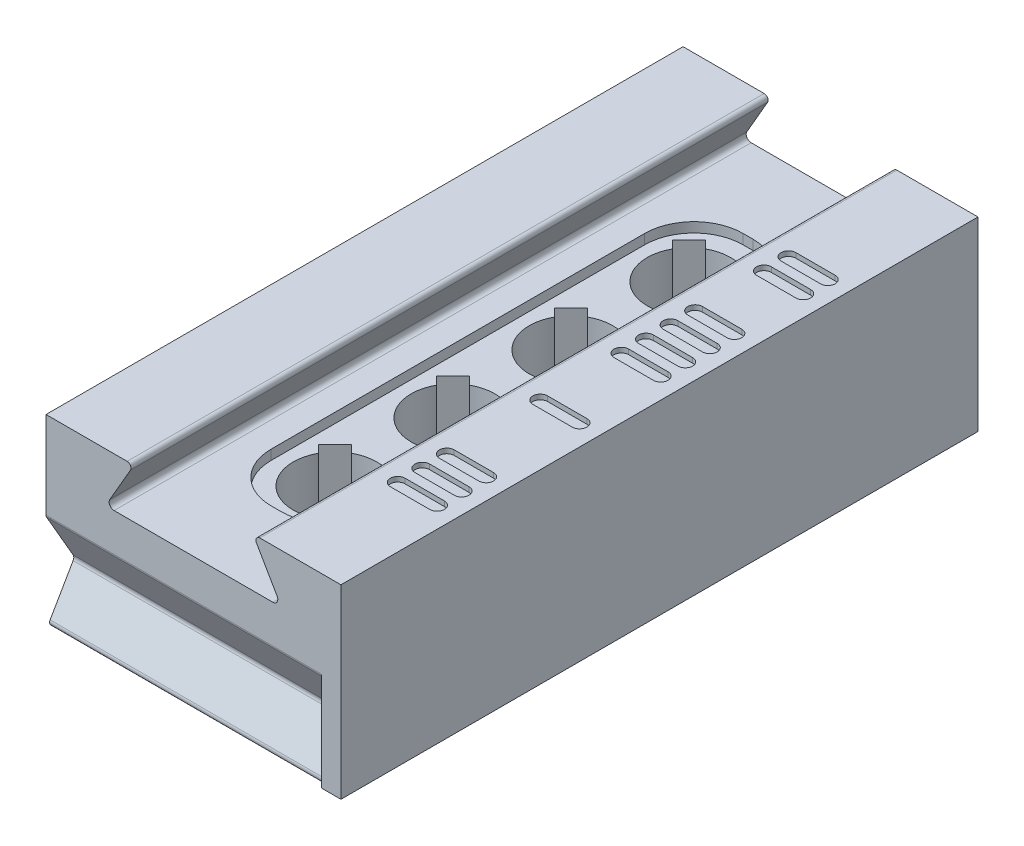
from build123d import *

# Parameters (mm, degrees)
BOSS_EXTRUDE1_DEPTH     = 15
CUT_EXTRUDE1_DEPTH      = 41.397648446
CUT_EXTRUDE1_DEPTH_BACK = 41.397648446
FILLET1_R               = 0.4
FILLET2_R               = 0.5
CUT_EXTRUDE2_REACH      = 40.314
SKETCH3_R               = 4.25
CUT_EXTRUDE3_DEPTH      = 12.9
SKETCH6_W               = 11
SKETCH6_H               = 48
CUT_EXTRUDE4_DEPTH      = 1
FILLET3_R               = 5
CHAMFER1_SIZE           = 0.5
BOSS_EXTRUDE2_DEPTH     = 2
CUT_EXTRUDE5_DEPTH      = 24
CUT_EXTRUDE5_DEPTH_BACK = 24
CUT_EXTRUDE6_DEPTH      = 0.5


with BuildPart() as part:
    # Sketch1 → Boss-Extrude1 (new, symmetric)
    with BuildSketch(Plane(origin=(0, 0, 0), x_dir=(0, 0, -1), z_dir=(1, 0, 0))):
        Polygon((32.4, -8.973205081), (32.4, 0), (-32.4, 0), (-32.4, -8.973205081), (-29.4977786, -14), (-32.326794919, -18.9), (32.326794919, -18.9), (29.4977786, -14), align=None)
    extrude(amount=BOSS_EXTRUDE1_DEPTH, both=True)

    # Sketch2 → Cut-Extrude1 (cut, two sides: drawn at the far end of the back side and taken through both)
    with BuildSketch(Plane.XY.offset(-CUT_EXTRUDE1_DEPTH_BACK)):
        Polygon((8.943375673, -5), (-8.943375673, -5), (-6.056624327, 0), (0, 0), (6.056624327, 0), align=None)
    extrude(amount=CUT_EXTRUDE1_DEPTH + CUT_EXTRUDE1_DEPTH_BACK, mode=Mode.SUBTRACT)

    # Fillet1
    fillet1_edges = [part.edges().sort_by_distance(p)[0] for p in [
        (0, -18.9, -32.326794919),
        (0, -18.9, 32.326794919),
        (0, -8.973205081, 32.4),
        (0, -8.973205081, -32.4),
        (6.056624327, 0, 0),
        (-6.056624327, 0, 0),
    ]]
    fillet(fillet1_edges, radius=FILLET1_R)

    # Fillet2
    fillet2_edges = [part.edges().sort_by_distance(p)[0] for p in [
        (0, -14, -29.4977786),
        (0, -14, 29.4977786),
        (8.943375673, -5, 0),
        (-8.943375673, -5, 0),
    ]]
    fillet(fillet2_edges, radius=FILLET2_R)

    # Sketch3 → Cut-Extrude2 (cut, up to next)
    with BuildSketch(Plane(origin=(0, -5, 0), x_dir=(1, 0, 0), z_dir=(0, 1, 0)), mode=Mode.PRIVATE) as cut_extrude2_sk1:
        with Locations(Location((0, 18, 0), (0, 0, 270))):
            Circle(SKETCH3_R)
    cut_extrude2_tool1 = extrude(cut_extrude2_sk1.sketch, amount=-CUT_EXTRUDE2_REACH, mode=Mode.PRIVATE) & part.part
    # Sketch3 → Cut-Extrude2 (cut, up to next)
    with BuildSketch(Plane(origin=(0, -5, 0), x_dir=(1, 0, 0), z_dir=(0, 1, 0)), mode=Mode.PRIVATE) as cut_extrude2_sk2:
        with Locations(Location((0, -18, 0), (0, 0, 270))):
            Circle(SKETCH3_R)
    cut_extrude2_tool2 = extrude(cut_extrude2_sk2.sketch, amount=-CUT_EXTRUDE2_REACH, mode=Mode.PRIVATE) & part.part
    # Sketch3 → Cut-Extrude2 (cut, up to next)
    with BuildSketch(Plane(origin=(0, -5, 0), x_dir=(1, 0, 0), z_dir=(0, 1, 0)), mode=Mode.PRIVATE) as cut_extrude2_sk3:
        with Locations(Location((0, 6, 0), (0, 0, 270))):
            Circle(SKETCH3_R)
    cut_extrude2_tool3 = extrude(cut_extrude2_sk3.sketch, amount=-CUT_EXTRUDE2_REACH, mode=Mode.PRIVATE) & part.part
    # Sketch3 → Cut-Extrude2 (cut, up to next)
    with BuildSketch(Plane(origin=(0, -5, 0), x_dir=(1, 0, 0), z_dir=(0, 1, 0)), mode=Mode.PRIVATE) as cut_extrude2_sk4:
        with Locations(Location((0, -6, 0), (0, 0, 270))):
            Circle(SKETCH3_R)
    cut_extrude2_tool4 = extrude(cut_extrude2_sk4.sketch, amount=-CUT_EXTRUDE2_REACH, mode=Mode.PRIVATE) & part.part
    add(cut_extrude2_tool1.solids().sort_by_distance((0, -5, -18))[0], mode=Mode.SUBTRACT)
    add(cut_extrude2_tool2.solids().sort_by_distance((0, -5, 18))[0], mode=Mode.SUBTRACT)
    add(cut_extrude2_tool3.solids().sort_by_distance((0, -5, -6))[0], mode=Mode.SUBTRACT)
    add(cut_extrude2_tool4.solids().sort_by_distance((0, -5, 6))[0], mode=Mode.SUBTRACT)

    # Sketch5 → Cut-Extrude3 (cut)
    with BuildSketch(Plane(origin=(0, -5, 0), x_dir=(1, 0, 0), z_dir=(0, 1, 0))):
        Polygon((-2.828427125, 22.5254834), (4.5254834, 15.171572875), (2.828427125, 13.4745166), (-4.5254834, 20.828427125), align=None)
        Polygon((-2.828427125, 10.5254834), (4.5254834, 3.171572875), (2.828427125, 1.4745166), (-4.5254834, 8.828427125), align=None)
        Polygon((-2.828427125, -1.4745166), (4.5254834, -8.828427125), (2.828427125, -10.5254834), (-4.5254834, -3.171572875), align=None)
        Polygon((-2.828427125, -13.4745166), (4.5254834, -20.828427125), (2.828427125, -22.5254834), (-4.5254834, -15.171572875), align=None)
    extrude(amount=-CUT_EXTRUDE3_DEPTH, mode=Mode.SUBTRACT)

    # Sketch6 → Cut-Extrude4 (cut)
    with BuildSketch(Plane(origin=(0, -5, 0), x_dir=(1, 0, 0), z_dir=(0, 1, 0))):
        Rectangle(SKETCH6_W, SKETCH6_H)
    extrude(amount=-CUT_EXTRUDE4_DEPTH, mode=Mode.SUBTRACT)

    # Fillet3
    fillet3_edges = [part.edges().sort_by_distance(p)[0] for p in [
        (-5.5, -5.5, 24),
        (-5.5, -5.5, -24),
        (5.5, -5.5, -24),
        (5.5, -5.5, 24),
    ]]
    fillet(fillet3_edges, radius=FILLET3_R)

    # Chamfer1
    chamfer1_edges = [part.edges().sort_by_distance(p)[0] for p in [
        (0, -18.9, 13.75),
        (0, -18.9, -22.25),
        (0, -18.9, 1.75),
        (0, -18.9, -10.25),
    ]]
    chamfer(chamfer1_edges, length=CHAMFER1_SIZE)

    # Sketch8 → Boss-Extrude2 (add)
    with BuildSketch(Plane(origin=(15, 0, 0), x_dir=(0, 0, -1), z_dir=(1, 0, 0))):
        Polygon((-32.4, -8.866025404), (-32.4, -18.9), (-31.633974596, -18.9), (31.633974596, -18.9), (32.4, -18.9), (32.4, -8.866025404), (32.4, 0), (-32.4, 0), align=None)
    extrude(amount=-BOSS_EXTRUDE2_DEPTH)

    # Sketch9 → Cut-Extrude5 (cut, two sides: drawn at the far end of the back side and taken through both)
    with BuildSketch(Plane.XY.offset(-CUT_EXTRUDE5_DEPTH_BACK)):
        Polygon((-15, -18.9), (-9, -18.9), (-15, -12.9), align=None)
    extrude(amount=CUT_EXTRUDE5_DEPTH + CUT_EXTRUDE5_DEPTH_BACK, mode=Mode.SUBTRACT)

    # Sketch10 → Cut-Extrude6 (cut)
    with BuildSketch(Plane(origin=(0, 0, 0), x_dir=(1, 0, 0), z_dir=(0, 1, 0))):
        with BuildLine():
            Line((8.874722325, -5.25), (12.874722325, -5.25))
            ThreePointArc((12.874722325, -5.25), (13.624722325, -6), (12.874722325, -6.75))
            Line((12.874722325, -6.75), (8.874722325, -6.75))
            ThreePointArc((8.874722325, -6.75), (8.124722325, -6), (8.874722325, -5.25))
        make_face()
        with BuildLine():
            Line((8.874722325, 17.5), (12.874722325, 17.5))
            ThreePointArc((12.874722325, 17.5), (13.624722325, 16.75), (12.874722325, 16))
            Line((12.874722325, 16), (8.874722325, 16))
            ThreePointArc((8.874722325, 16), (8.124722325, 16.75), (8.874722325, 17.5))
        make_face()
        with BuildLine():
            Line((8.874722325, 20), (12.874722325, 20))
            ThreePointArc((12.874722325, 20), (13.624722325, 19.25), (12.874722325, 18.5))
            Line((12.874722325, 18.5), (8.874722325, 18.5))
            ThreePointArc((8.874722325, 18.5), (8.124722325, 19.25), (8.874722325, 20))
        make_face()
        with BuildLine():
            Line((8.874722325, -19.75), (12.874722325, -19.75))
            ThreePointArc((12.874722325, -19.75), (13.624722325, -20.5), (12.874722325, -21.25))
            Line((12.874722325, -21.25), (8.874722325, -21.25))
            ThreePointArc((8.874722325, -21.25), (8.124722325, -20.5), (8.874722325, -19.75))
        make_face()
        with BuildLine():
            Line((8.874722325, -17.25), (12.874722325, -17.25))
            ThreePointArc((12.874722325, -17.25), (13.624722325, -18), (12.874722325, -18.75))
            Line((12.874722325, -18.75), (8.874722325, -18.75))
            ThreePointArc((8.874722325, -18.75), (8.124722325, -18), (8.874722325, -17.25))
        make_face()
        with BuildLine():
            Line((8.874722325, -14.75), (12.874722325, -14.75))
            ThreePointArc((12.874722325, -14.75), (13.624722325, -15.5), (12.874722325, -16.25))
            Line((12.874722325, -16.25), (8.874722325, -16.25))
            ThreePointArc((8.874722325, -16.25), (8.124722325, -15.5), (8.874722325, -14.75))
        make_face()
        with BuildLine():
            Line((8.874722325, 5.5), (12.874722325, 5.5))
            ThreePointArc((12.874722325, 5.5), (13.624722325, 4.75), (12.874722325, 4))
            Line((12.874722325, 4), (8.874722325, 4))
            ThreePointArc((8.874722325, 4), (8.124722325, 4.75), (8.874722325, 5.5))
        make_face()
        with BuildLine():
            Line((8.874722325, 8), (12.874722325, 8))
            ThreePointArc((12.874722325, 8), (13.624722325, 7.25), (12.874722325, 6.5))
            Line((12.874722325, 6.5), (8.874722325, 6.5))
            ThreePointArc((8.874722325, 6.5), (8.124722325, 7.25), (8.874722325, 8))
        make_face()
        with BuildLine():
            Line((8.874722325, 10.5), (12.874722325, 10.5))
            ThreePointArc((12.874722325, 10.5), (13.624722325, 9.75), (12.874722325, 9))
            Line((12.874722325, 9), (8.874722325, 9))
            ThreePointArc((8.874722325, 9), (8.124722325, 9.75), (8.874722325, 10.5))
        make_face()
        with BuildLine():
            Line((8.874722325, 3), (12.874722325, 3))
            ThreePointArc((12.874722325, 3), (13.624722325, 2.25), (12.874722325, 1.5))
            Line((12.874722325, 1.5), (8.874722325, 1.5))
            ThreePointArc((8.874722325, 1.5), (8.124722325, 2.25), (8.874722325, 3))
        make_face()
    extrude(amount=-CUT_EXTRUDE6_DEPTH, mode=Mode.SUBTRACT)


solid = part.part
